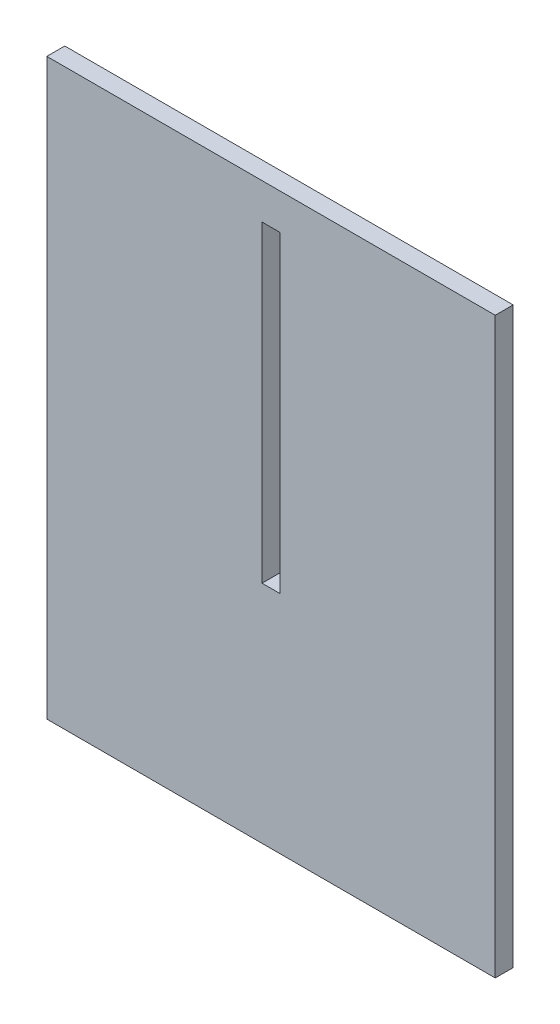
from build123d import *

# Parameters (mm, degrees)
SKETCH1_W           = 125
SKETCH1_H           = 160
SKETCH1_W_2         = 5
SKETCH1_H_2         = 87.189225364
BOSS_EXTRUDE1_DEPTH = 5


with BuildPart() as part:
    # Sketch1 → Boss-Extrude1 (new body)
    with BuildSketch(Plane.XY):
        with Locations((62.5, -80)):
            Rectangle(SKETCH1_W, SKETCH1_H)
        with Locations((62.5, -53.594612682)):
            Rectangle(SKETCH1_W_2, SKETCH1_H_2, mode=Mode.SUBTRACT)
    extrude(amount=BOSS_EXTRUDE1_DEPTH)


solid = part.part
